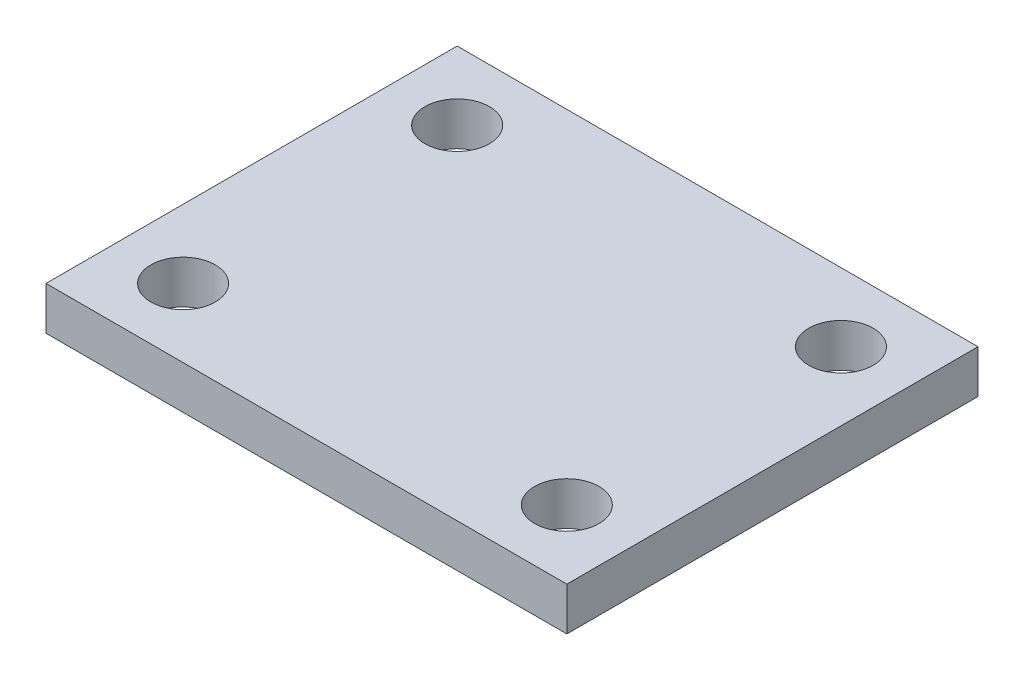
from build123d import *

# Parameters (mm, degrees)
SKETCH1_W           = 19.304
SKETCH1_H           = 15.24
SKETCH1_R           = 1.1938
BOSS_EXTRUDE1_DEPTH = 1.6


with BuildPart() as part:
    # Sketch1 → Boss-Extrude1 (new body)
    with BuildSketch(Plane(origin=(0, 0, 0), x_dir=(1, 0, 0), z_dir=(0, 1, 0))):
        Rectangle(SKETCH1_W, SKETCH1_H)
        with Locations(Location((7.112, 5.08, 0), (0, 0, 270))):
            Circle(SKETCH1_R, mode=Mode.SUBTRACT)
        with Locations(Location((7.112, -5.08, 0), (0, 0, 270))):
            Circle(SKETCH1_R, mode=Mode.SUBTRACT)
        with Locations(Location((-7.112, -5.08, 0), (0, 0, 270))):
            Circle(SKETCH1_R, mode=Mode.SUBTRACT)
        with Locations(Location((-7.112, 5.08, 0), (0, 0, 270))):
            Circle(SKETCH1_R, mode=Mode.SUBTRACT)
    extrude(amount=BOSS_EXTRUDE1_DEPTH)


solid = part.part
